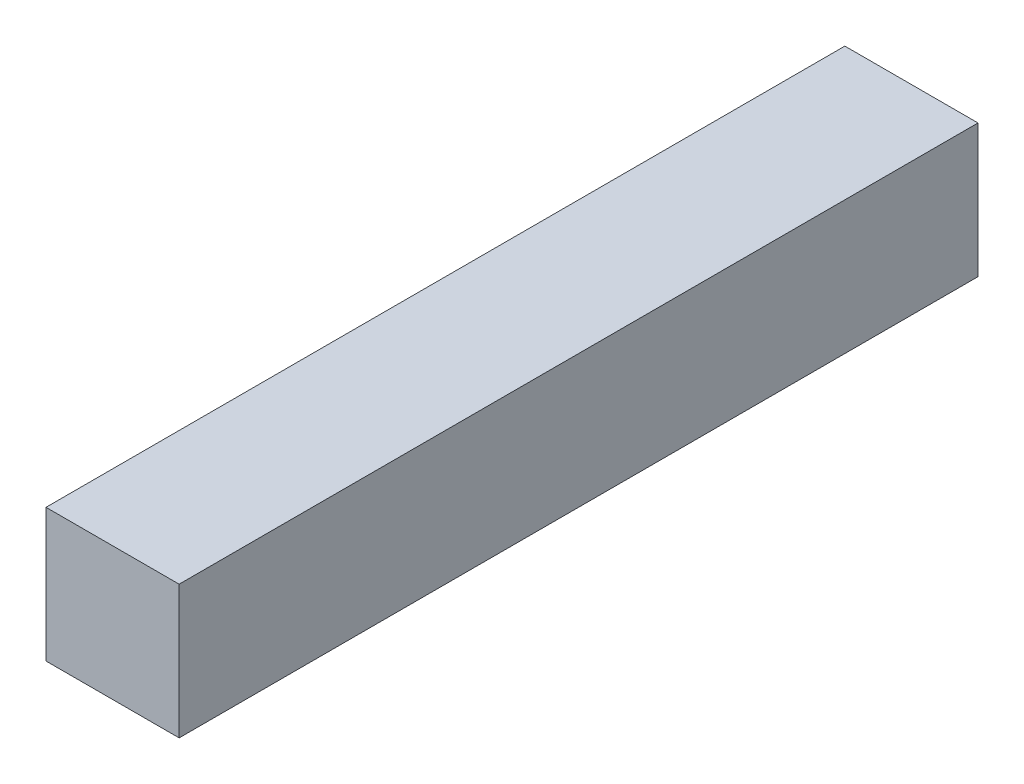
from build123d import *

# Parameters (mm, degrees)
SKETCH1_W           = 5
SKETCH1_H           = 5
BOSS_EXTRUDE1_DEPTH = 30


with BuildPart() as part:
    # Sketch1 → Boss-Extrude1 (new body)
    with BuildSketch(Plane.XY):
        with Locations((2.5, 2.5)):
            Rectangle(SKETCH1_W, SKETCH1_H)
    extrude(amount=BOSS_EXTRUDE1_DEPTH)


solid = part.part
